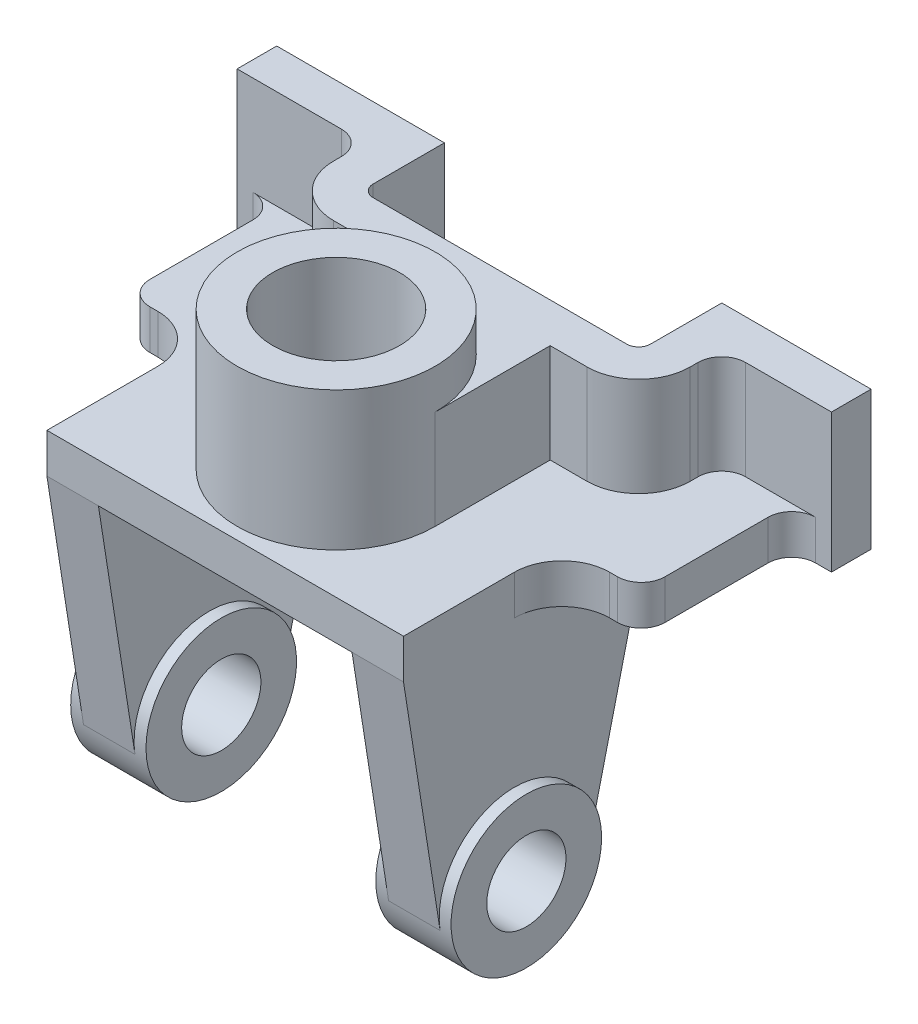
from build123d import *

# Parameters (mm, degrees)
SKETCH1_R           = 25
BOSS_EXTRUDE1_DEPTH = 45
BOSS_EXTRUDE2_DEPTH = 35
BOSS_EXTRUDE3_DEPTH = 10
SKETCH2_R           = 16
CUT_EXTRUDE1_DEPTH  = 82
SKETCH3_R           = 10
BOSS_EXTRUDE6_DEPTH = 13
BOSS_EXTRUDE7_START = 3
SKETCH6_R           = 19
SKETCH6_R_2         = 10
BOSS_EXTRUDE7_DEPTH = 3
SKETCH7_R           = 19
SKETCH7_R_2         = 10
BOSS_EXTRUDE8_DEPTH = 3


with BuildPart() as part:
    # Sketch1 → Boss-Extrude1 (new body)
    with BuildSketch(Plane(origin=(0, 0, 0), x_dir=(1, 0, 0), z_dir=(0, 1, 0))):
        with Locations((0, -16)):
            Circle(SKETCH1_R)
    extrude(amount=BOSS_EXTRUDE1_DEPTH)

    # Sketch1<3> → Boss-Extrude2 (add)
    with BuildSketch(Plane(origin=(0, 0, 0), x_dir=(1, 0, 0), z_dir=(0, 1, 0))):
        with BuildLine():
            Line((-25, 13.01303268), (-25, -16))
            ThreePointArc((-25, -16), (0, 9), (25, -16))
            Line((25, -16), (25, 13.01303268))
            Line((25, 13.01303268), (34.321906288, 13.01303268))
            ThreePointArc((34.321906288, 13.01303268), (43.514294444, 16.820644525), (47.321906288, 26.01303268))
            Line((47.321906288, 26.01303268), (47.321906288, 28))
            ThreePointArc((47.321906288, 28), (49.079265601, 32.242640687), (53.321906288, 34))
            Line((53.321906288, 34), (75, 34))
            Line((75, 34), (75, 44))
            Line((75, 44), (37.321906288, 44))
            Line((37.321906288, 44), (37.321906288, 26.01303268))
            ThreePointArc((37.321906288, 26.01303268), (36.443226632, 23.891712336), (34.321906288, 23.01303268))
            Line((34.321906288, 23.01303268), (-29.678093712, 23.01303268))
            ThreePointArc((-29.678093712, 23.01303268), (-31.799414055, 23.891712336), (-32.678093712, 26.01303268))
            Line((-32.678093712, 26.01303268), (-32.678093712, 44))
            Line((-32.678093712, 44), (-75, 44))
            Line((-75, 44), (-75, 34))
            Line((-75, 34), (-48.678093712, 34))
            ThreePointArc((-48.678093712, 34), (-44.435453024, 32.242640687), (-42.678093712, 28))
            Line((-42.678093712, 28), (-42.678093712, 26.01303268))
            ThreePointArc((-42.678093712, 26.01303268), (-38.870481867, 16.820644525), (-29.678093712, 13.01303268))
            Line((-29.678093712, 13.01303268), (-25, 13.01303268))
        make_face()
    extrude(amount=BOSS_EXTRUDE2_DEPTH)

    # Sketch1<4> → Boss-Extrude3 (add)
    with BuildSketch(Plane(origin=(0, 0, 0), x_dir=(1, 0, 0), z_dir=(0, 1, 0))):
        with BuildLine():
            Line((-45, -16), (-45, -44))
            Line((-45, -44), (45, -44))
            Line((45, -44), (45, -16))
            ThreePointArc((45, -16), (48.514718626, -7.514718626), (57, -4))
            Line((57, -4), (59, -4))
            ThreePointArc((59, -4), (63.242640687, -2.242640687), (65, 2))
            Line((65, 2), (65, 28))
            ThreePointArc((65, 28), (66.757359313, 32.242640687), (71, 34))
            Line((71, 34), (53.321906288, 34))
            ThreePointArc((53.321906288, 34), (49.079265601, 32.242640687), (47.321906288, 28))
            Line((47.321906288, 28), (47.321906288, 26.01303268))
            ThreePointArc((47.321906288, 26.01303268), (43.514294444, 16.820644525), (34.321906288, 13.01303268))
            Line((34.321906288, 13.01303268), (25, 13.01303268))
            Line((25, 13.01303268), (25, -16))
            ThreePointArc((25, -16), (0, -41), (-25, -16))
            Line((-25, -16), (-25, 13.01303268))
            Line((-25, 13.01303268), (-29.678093712, 13.01303268))
            ThreePointArc((-29.678093712, 13.01303268), (-38.870481867, 16.820644525), (-42.678093712, 26.01303268))
            Line((-42.678093712, 26.01303268), (-42.678093712, 28))
            ThreePointArc((-42.678093712, 28), (-44.435453024, 32.242640687), (-48.678093712, 34))
            Line((-48.678093712, 34), (-71, 34))
            ThreePointArc((-71, 34), (-66.757359313, 32.242640687), (-65, 28))
            Line((-65, 28), (-65, 2))
            ThreePointArc((-65, 2), (-63.242640687, -2.242640687), (-59, -4))
            Line((-59, -4), (-57, -4))
            ThreePointArc((-57, -4), (-48.514718626, -7.514718626), (-45, -16))
        make_face()
    extrude(amount=BOSS_EXTRUDE3_DEPTH)

    # Sketch2 → Cut-Extrude1 (cut)
    with BuildSketch(Plane(origin=(0, 45, 0), x_dir=(1, 0, 0), z_dir=(0, 1, 0))):
        with Locations((0, -16)):
            Circle(SKETCH2_R)
    extrude(amount=-CUT_EXTRUDE1_DEPTH, mode=Mode.SUBTRACT)

    # Sketch3 → Boss-Extrude6 (add)
    with BuildSketch(Plane(origin=(45, 0, 0), x_dir=(0, 0, -1), z_dir=(1, 0, 0))):
        with BuildLine():
            Line((17, 0), (-44, 0))
            Line((-44, 0), (-34.771282059, -58.939212458))
            ThreePointArc((-34.771282059, -58.939212458), (-16, -75), (2.771282059, -58.939212458))
            Line((2.771282059, -58.939212458), (17, 0))
        make_face()
        with Locations((-16, -56)):
            Circle(SKETCH3_R, mode=Mode.SUBTRACT)
    boss_extrude6 = extrude(amount=-BOSS_EXTRUDE6_DEPTH)

    # Sketch6 → Boss-Extrude7 (add)
    with BuildSketch(Plane(origin=(45, 0, 0), x_dir=(0, 0, -1), z_dir=(1, 0, 0)).offset(BOSS_EXTRUDE7_START)):
        with Locations((-16, -56)):
            Circle(SKETCH6_R)
        with Locations((-16, -56)):
            Circle(SKETCH6_R_2, mode=Mode.SUBTRACT)
    boss_extrude7 = extrude(amount=-BOSS_EXTRUDE7_DEPTH)

    # Sketch7 → Boss-Extrude8 (add)
    with BuildSketch(Plane.ZY.offset(-32)):
        with Locations((16, -56)):
            Circle(SKETCH7_R)
        with Locations((16, -56)):
            Circle(SKETCH7_R_2, mode=Mode.SUBTRACT)
    boss_extrude8 = extrude(amount=BOSS_EXTRUDE8_DEPTH)

    # Mirror1: Boss-Extrude6, Boss-Extrude7, Boss-Extrude8 across plane
    add(boss_extrude6.mirror(Plane(origin=(0, 0, 0), x_dir=(0, 0, 1), z_dir=(1, 0, 0))))
    add(boss_extrude7.mirror(Plane(origin=(0, 0, 0), x_dir=(0, 0, 1), z_dir=(1, 0, 0))))
    add(boss_extrude8.mirror(Plane(origin=(0, 0, 0), x_dir=(0, 0, 1), z_dir=(1, 0, 0))))


solid = part.part
